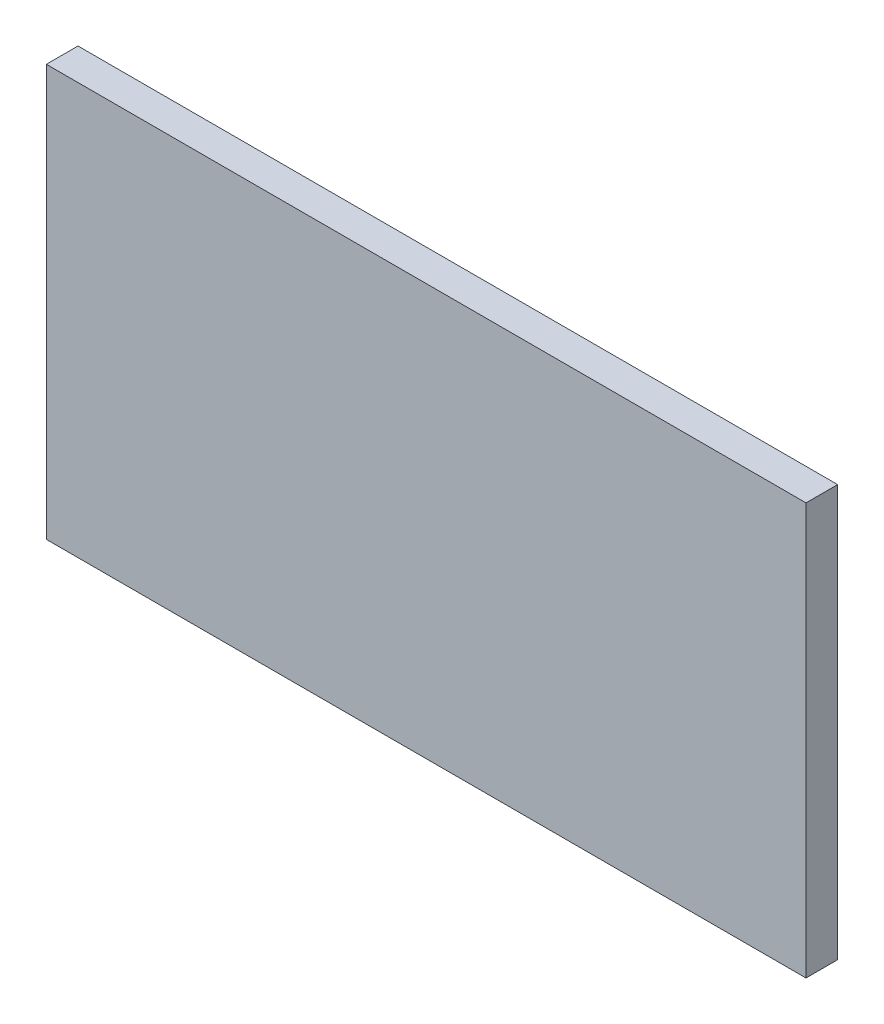
from build123d import *

# Parameters (mm, degrees)
SKETCH1_W           = 24
SKETCH1_H           = 13
BOSS_EXTRUDE1_DEPTH = 1


with BuildPart() as part:
    # Sketch1 → Boss-Extrude1 (new body)
    with BuildSketch(Plane.XY):
        with Locations((-12, 6.5)):
            Rectangle(SKETCH1_W, SKETCH1_H)
    extrude(amount=BOSS_EXTRUDE1_DEPTH)


solid = part.part
